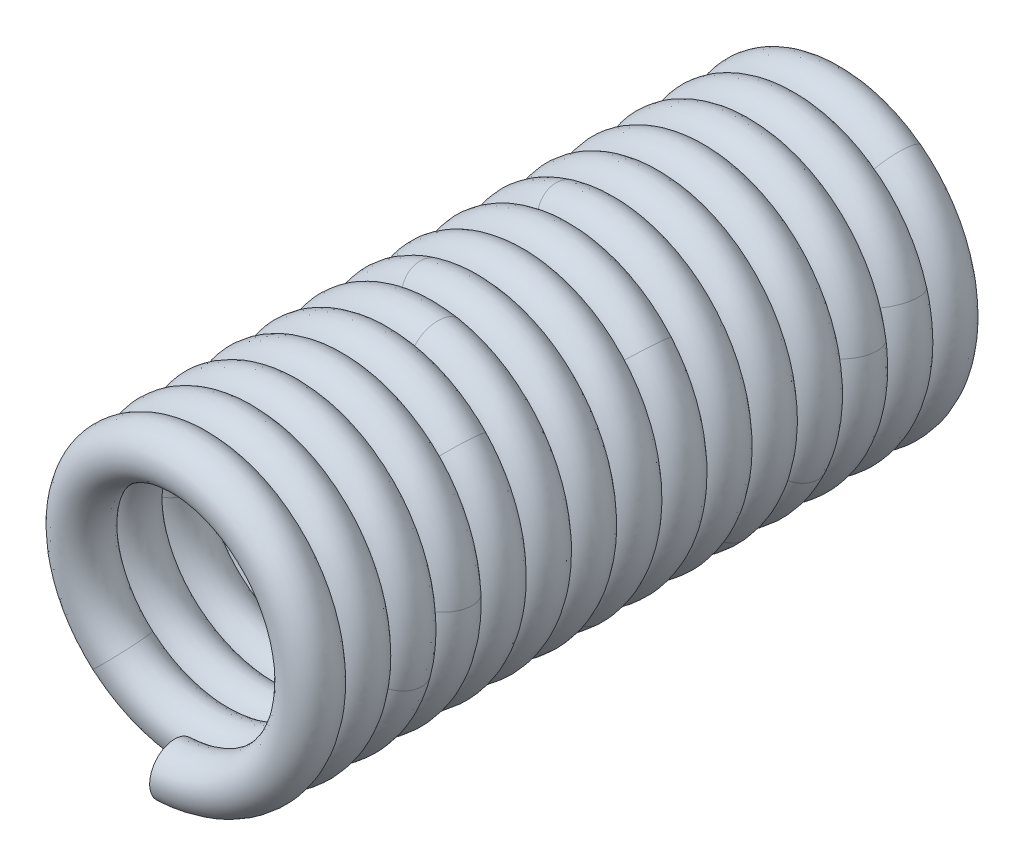
from build123d import *

# Parameters (mm, degrees)
SWEEP1_PITCH       = 2.286
SWEEP1_HEIGHT      = 34.29
SWEEP1_RADIUS      = 6.35
SWEEP1_START_ANGLE = -90
SWEEP1_PROFILE_R   = 1.27


with BuildPart() as part:
    # Sweep1: sweep along a helix
    with BuildLine() as sweep1_path:
        add(Helix(SWEEP1_PITCH, SWEEP1_HEIGHT, SWEEP1_RADIUS, center=(0, 0, 0), direction=(0, 0, 1), lefthand=True, mode=Mode.PRIVATE).rotate(Axis((0, 0, 0), (0, 0, 1)), SWEEP1_START_ANGLE))
    # Sweep1 profile (on start of the path) → Sweep1 (sweep)
    with BuildSketch(Plane(origin=(0, -6.35, 0), x_dir=(-0.05720196495684604, 0, -0.9983626271075434), z_dir=(-0.9983626271075434, -1.952172595504798e-13, 0.05720196495684604))):
        Circle(SWEEP1_PROFILE_R)
    sweep(path=sweep1_path.line, is_frenet=True)


solid = part.part
